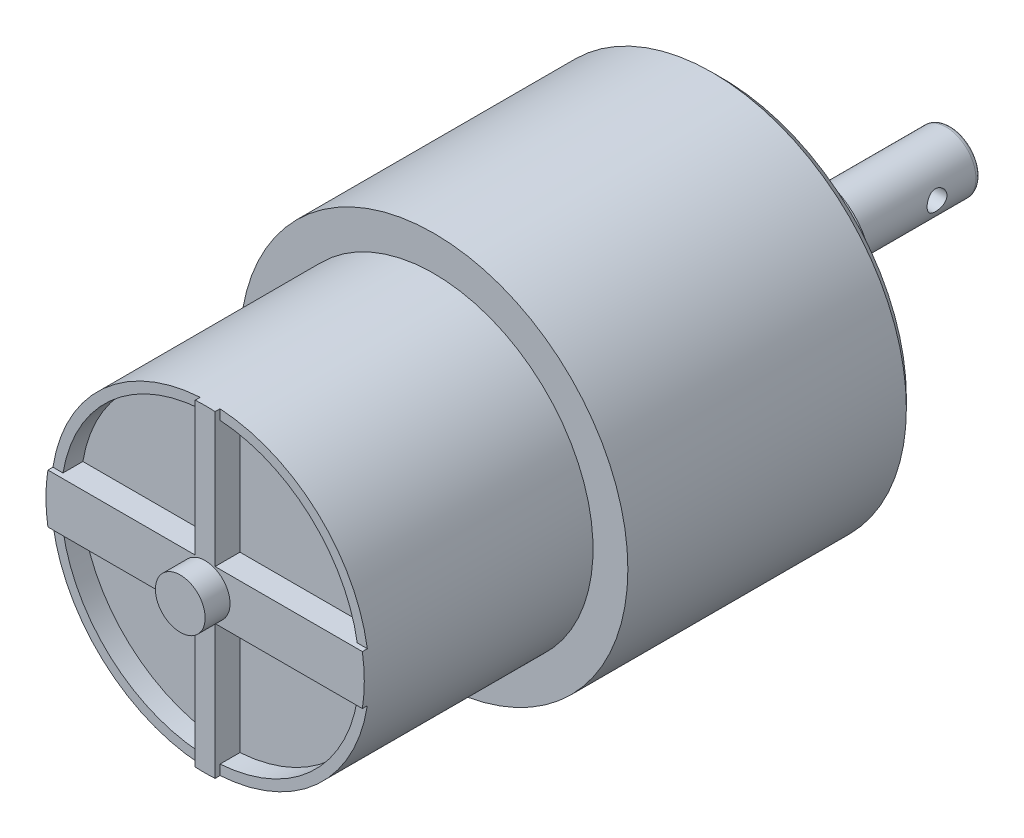
from build123d import *
from build123d.topology import SkipClean

# Parameters (mm, degrees)
SKETCH1_R               = 16
BOSS_EXTRUDE1_DEPTH     = 23
SKETCH2_R               = 19.5
BOSS_EXTRUDE2_DEPTH     = 29
SKETCH3_R               = 6
BOSS_EXTRUDE4_DEPTH     = 9
SKETCH4_R               = 3
BOSS_EXTRUDE5_DEPTH     = 22
CUT_EXTRUDE2_DEPTH      = 22
CUT_EXTRUDE2_DEPTH_BACK = 22
SKETCH5_R               = 1.5
CUT_EXTRUDE4_START      = -2.5
CUT_EXTRUDE4_DEPTH      = 2.5
SKETCH7_R               = 2.5
BOSS_EXTRUDE6_DEPTH     = 2.5
BOSS_EXTRUDE7_DEPTH     = 2
CHAMFER1_SIZE           = 1
FILLET1_R               = 1
BOSS_EXTRUDE8_START     = -22
SKETCH9_R               = 3
BOSS_EXTRUDE8_DEPTH     = 22
CUT_EXTRUDE6_START      = -8
SKETCH10_R              = 3
CUT_EXTRUDE6_DEPTH      = 8
FILLET2_R               = 0.5
CUT_EXTRUDE7_DEPTH      = 59.860003398
CUT_EXTRUDE7_DEPTH_BACK = 59.860003398
SKETCH11_R              = 1


with BuildPart() as part:
    # Sketch1 → Boss-Extrude1 (new body)
    with BuildSketch(Plane.XY):
        Circle(SKETCH1_R)
    extrude(amount=BOSS_EXTRUDE1_DEPTH)

    # Sketch2 → Boss-Extrude2 (add)
    with BuildSketch(Plane(origin=(0, 0, 0), x_dir=(-1, 0, 0), z_dir=(0, 0, -1))):
        Circle(SKETCH2_R)
    extrude(amount=BOSS_EXTRUDE2_DEPTH)

    # Sketch3 → Boss-Extrude4 (add)
    with BuildSketch(Plane(origin=(0, 0, -29), x_dir=(-1, 0, 0), z_dir=(0, 0, -1))):
        Circle(SKETCH3_R)
    extrude(amount=BOSS_EXTRUDE4_DEPTH)

    # Sketch4 → Boss-Extrude5 (add)
    with BuildSketch(Plane(origin=(0, 0, -38), x_dir=(-1, 0, 0), z_dir=(0, 0, -1))):
        Circle(SKETCH4_R)
    extrude(amount=BOSS_EXTRUDE5_DEPTH)

    # Sketch5 → Cut-Extrude2 (cut, two sides: drawn at the far end of the back side and taken through both)
    with BuildSketch(Plane(origin=(0, 0, 0), x_dir=(0, 0, -1), z_dir=(1, 0, 0)).offset(-CUT_EXTRUDE2_DEPTH_BACK)):
        with Locations((52, 0)):
            Circle(SKETCH5_R)
    extrude(amount=CUT_EXTRUDE2_DEPTH + CUT_EXTRUDE2_DEPTH_BACK, mode=Mode.SUBTRACT)

    # Sketch6 → Cut-Extrude4 (cut)
    with BuildSketch(Plane.XY.offset(23).offset(CUT_EXTRUDE4_START)):
        with BuildLine():
            Line((0.998052578, -2.481549033), (0.998052578, -15.968841256))
            ThreePointArc((0.998052578, -15.968841256), (10.773767775, -11.829029036), (15.806388405, -2.481549033))
            Line((15.806388405, -2.481549033), (0.998052578, -2.481549033))
        make_face()
        with BuildLine():
            Line((-0.998052578, 15.968841256), (-0.998052578, 2.481549033))
            Line((-0.998052578, 2.481549033), (-15.806388405, 2.481549033))
            ThreePointArc((-15.806388405, 2.481549033), (-10.773767775, 11.829029036), (-0.998052578, 15.968841256))
        make_face()
        with BuildLine():
            Line((0.998052578, 15.968841256), (0.998052578, 2.481549033))
            Line((0.998052578, 2.481549033), (15.806388405, 2.481549033))
            ThreePointArc((15.806388405, 2.481549033), (10.773767775, 11.829029036), (0.998052578, 15.968841256))
        make_face()
        with BuildLine():
            Line((-15.806388405, -2.481549033), (-0.998052578, -2.481549033))
            Line((-0.998052578, -2.481549033), (-0.998052578, -15.968841256))
            ThreePointArc((-0.998052578, -15.968841256), (-10.773767775, -11.829029036), (-15.806388405, -2.481549033))
        make_face()
    extrude(amount=CUT_EXTRUDE4_DEPTH, mode=Mode.SUBTRACT)

    # Sketch7 → Boss-Extrude6 (add)
    with BuildSketch(Plane.XY.offset(23)):
        Circle(SKETCH7_R)
    extrude(amount=BOSS_EXTRUDE6_DEPTH)

    # Sketch8 → Boss-Extrude7 (add)
    with BuildSketch(Plane.XY.offset(20.5)):
        with BuildLine():
            Line((-15.806388405, 2.481549033), (-14.793306405, 2.481549033))
            ThreePointArc((-14.793306405, 2.481549033), (-10.065380021, 11.12151631), (-0.998052578, 14.966759537))
            Line((-0.998052578, 14.966759537), (-0.998052578, 15.968841256))
            ThreePointArc((-0.998052578, 15.968841256), (-10.773767775, 11.829029036), (-15.806388405, 2.481549033))
        make_face()
        with BuildLine():
            Line((0.998052578, 15.968841256), (0.998052578, 14.966759537))
            ThreePointArc((0.998052578, 14.966759537), (10.065380021, 11.12151631), (14.793306405, 2.481549033))
            Line((14.793306405, 2.481549033), (15.806388405, 2.481549033))
            ThreePointArc((15.806388405, 2.481549033), (10.773767775, 11.829029036), (0.998052578, 15.968841256))
        make_face()
        with BuildLine():
            Line((15.806388405, -2.481549033), (14.793306405, -2.481549033))
            ThreePointArc((14.793306405, -2.481549033), (10.065380021, -11.12151631), (0.998052578, -14.966759537))
            Line((0.998052578, -14.966759537), (0.998052578, -15.968841256))
            ThreePointArc((0.998052578, -15.968841256), (10.773767775, -11.829029036), (15.806388405, -2.481549033))
        make_face()
        with BuildLine():
            Line((-0.998052578, -15.968841256), (-0.998052578, -14.966759537))
            ThreePointArc((-0.998052578, -14.966759537), (-10.065380021, -11.12151631), (-14.793306405, -2.481549033))
            Line((-14.793306405, -2.481549033), (-15.806388405, -2.481549033))
            ThreePointArc((-15.806388405, -2.481549033), (-10.773767775, -11.829029036), (-0.998052578, -15.968841256))
        make_face()
    extrude(amount=BOSS_EXTRUDE7_DEPTH)

    # Chamfer1
    chamfer1_edges = [part.edges().sort_by_distance(p)[0] for p in [
        (19.5, 0, -29),
    ]]
    chamfer(chamfer1_edges, length=CHAMFER1_SIZE)

    # Fillet1
    fillet1_edges = [part.edges().sort_by_distance(p)[0] for p in [
        (3, 0, -60),
    ]]
    fillet(fillet1_edges, radius=FILLET1_R)

    # Sketch9 → Boss-Extrude8 (add)
    with SkipClean():  # the faces are left unmerged after this step: merging them gives an invalid solid
        with BuildSketch(Plane(origin=(0, 0, -60), x_dir=(-1, 0, 0), z_dir=(0, 0, -1)).offset(BOSS_EXTRUDE8_START)):
            Circle(SKETCH9_R)
        extrude(amount=BOSS_EXTRUDE8_DEPTH)

    # Sketch10 → Cut-Extrude6 (cut)
    with BuildSketch(Plane(origin=(0, 0, -60), x_dir=(-1, 0, 0), z_dir=(0, 0, -1)).offset(CUT_EXTRUDE6_START)):
        Circle(SKETCH10_R)
    extrude(amount=CUT_EXTRUDE6_DEPTH, mode=Mode.SUBTRACT)

    # Fillet2
    fillet2_edges = [part.edges().sort_by_distance(p)[0] for p in [
        (3, 0, -52),
    ]]
    fillet(fillet2_edges, radius=FILLET2_R)

    # Sketch11 → Cut-Extrude7 (cut, two sides: drawn at the far end of the back side and taken through both)
    with BuildSketch(Plane(origin=(0, 0, 0), x_dir=(0, 0, -1), z_dir=(1, 0, 0)).offset(-CUT_EXTRUDE7_DEPTH_BACK)):
        with Locations((47.584115537, 0)):
            Circle(SKETCH11_R)
    extrude(amount=CUT_EXTRUDE7_DEPTH + CUT_EXTRUDE7_DEPTH_BACK, mode=Mode.SUBTRACT)


solid = part.part
